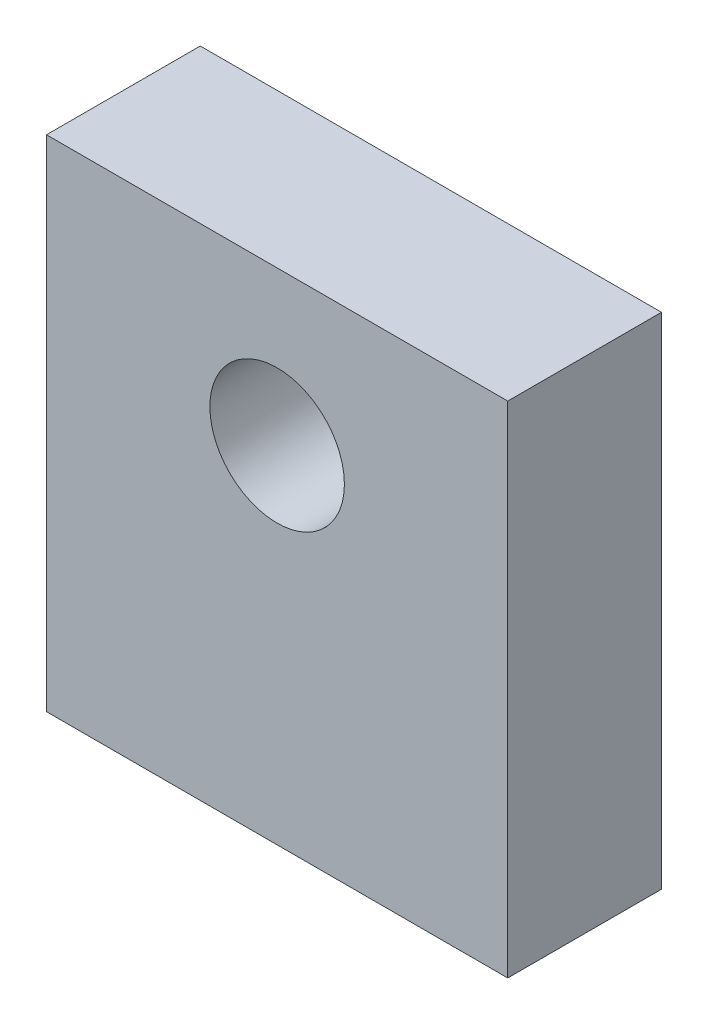
from build123d import *

# Parameters (mm, degrees)
SKETCH1_W                  = 38.1
SKETCH1_H                  = 41.275
SKETCH1_R                  = 5.55625
BOSS_EXTRUDE1_DEPTH        = 12.7
F_10_32_TAPPED_HOLE1_D     = 4.0386
F_10_32_TAPPED_HOLE1_DEPTH = 15.875
F_10_32_TAPPED_HOLE1_TIP   = 1.213317848


with BuildPart() as part:
    # Sketch1 → Boss-Extrude1 (new body)
    with BuildSketch(Plane.XY):
        with Locations((0, 20.6375)):
            Rectangle(SKETCH1_W, SKETCH1_H)
        with Locations((0, 28.575)):
            Circle(SKETCH1_R, mode=Mode.SUBTRACT)
    extrude(amount=BOSS_EXTRUDE1_DEPTH)

    # #10-32 Tapped Hole1
    with Locations(Plane(origin=(0, 0, 0), x_dir=(-1, 0, 0), z_dir=(0, -1, 0))):
        with Locations((-13.97, -6.35), (13.97, -6.35)):
            Hole(F_10_32_TAPPED_HOLE1_D / 2, depth=F_10_32_TAPPED_HOLE1_DEPTH)
            with Locations((0, 0, -(F_10_32_TAPPED_HOLE1_DEPTH + F_10_32_TAPPED_HOLE1_TIP / 2))):  # 118° drill point
                Cone(0, F_10_32_TAPPED_HOLE1_D / 2, F_10_32_TAPPED_HOLE1_TIP, mode=Mode.SUBTRACT)


solid = part.part
